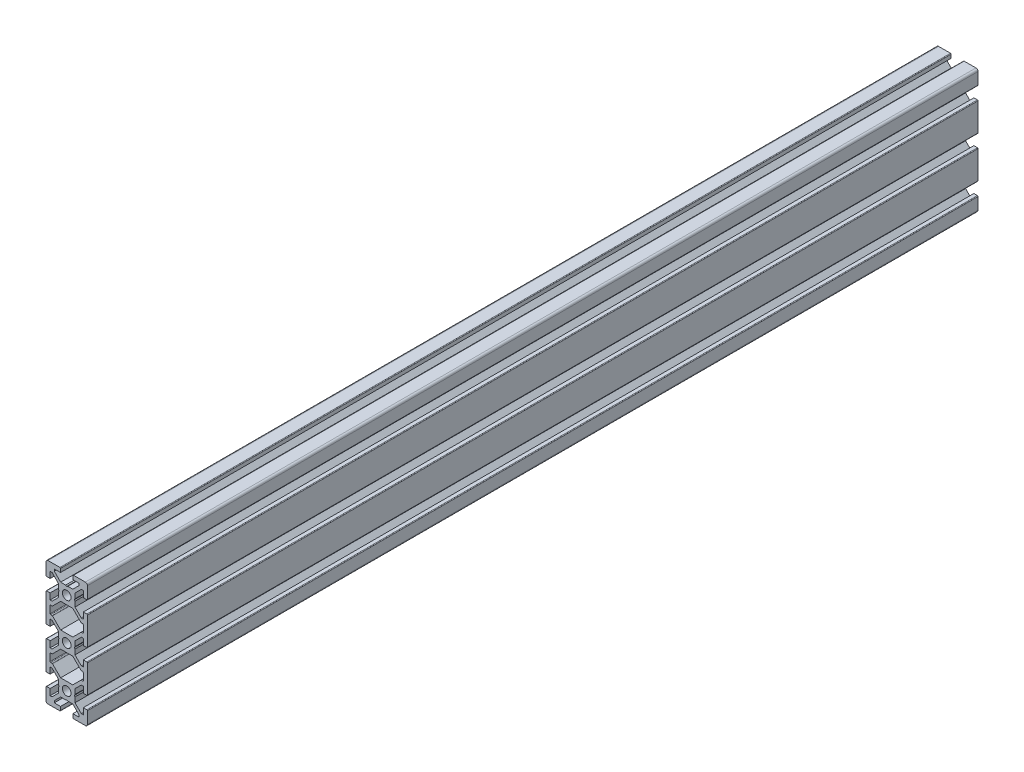
from build123d import *

# Parameters (mm, degrees)
SKETCH1_R           = 2.0999999
BOSS_EXTRUDE1_DEPTH = 430


with BuildPart() as part:
    # Sketch1 → Boss-Extrude1 (new body)
    with BuildSketch(Plane.XY):
        with BuildLine():
            Line((-10, 16.7), (-10, 3.3))
            ThreePointArc((-10, 3.3), (-9.912132034, 3.087867966), (-9.7, 3))
            Line((-9.7, 3), (-8, 3))
            Line((-8, 3), (-8, 6))
            Line((-8, 6), (-7.060650687, 6))
            Line((-7.060650687, 6), (-4, 2.939349))
            Line((-4, 2.939349), (-4, 0.519615242))
            Line((-4, 0.519615242), (-3.7, 0))
            Line((-3.7, 0), (-4, -0.519615242))
            Line((-4, -0.519615242), (-4, -2.9393502))
            Line((-4, -2.9393502), (-7.060649487, -6))
            Line((-7.060649487, -6), (-8, -6))
            Line((-8, -6), (-8, -3))
            Line((-8, -3), (-9.7, -3))
            ThreePointArc((-9.7, -3), (-9.912132034, -3.087867966), (-10, -3.3))
            Line((-10, -3.3), (-10, -16.7))
            ThreePointArc((-10, -16.7), (-9.912132034, -16.912132034), (-9.7, -17))
            Line((-9.7, -17), (-8, -17))
            Line((-8, -17), (-8, -14))
            Line((-8, -14), (-7.060672887, -14))
            Line((-7.060672887, -14), (-4, -17.0606732))
            Line((-4, -17.0606732), (-4, -19.480384758))
            Line((-4, -19.480384758), (-3.7, -20))
            Line((-3.7, -20), (-4, -20.519615242))
            Line((-4, -20.519615242), (-4, -22.93935665))
            Line((-4, -22.93935665), (-7.060643037, -26))
            Line((-7.060643037, -26), (-8, -26))
            Line((-8, -26), (-8, -23))
            Line((-8, -23), (-9.7, -23))
            ThreePointArc((-9.7, -23), (-9.912132034, -23.087867966), (-10, -23.3))
            Line((-10, -23.3), (-10, -29))
            ThreePointArc((-10, -29), (-9.707106781, -29.707106781), (-9, -30))
            Line((-9, -30), (-3.3, -30))
            ThreePointArc((-3.3, -30), (-3.087867966, -29.912132034), (-3, -29.7))
            Line((-3, -29.7), (-3, -28))
            Line((-3, -28), (-6, -28))
            Line((-6, -28), (-6, -27.060683408))
            Line((-6, -27.060683408), (-2.939316, -24))
            Line((-2.939316, -24), (-0.519095055, -24))
            Line((-0.519095055, -24), (1e-06, -23.7))
            Line((1e-06, -23.7), (0.518577868, -24))
            Line((0.518577868, -24), (2.939318, -24))
            Line((2.939318, -24), (6, -27.060682403))
            Line((6, -27.060682403), (6, -28))
            Line((6, -28), (3, -28))
            Line((3, -28), (3, -29.7))
            ThreePointArc((3, -29.7), (3.087867966, -29.912132034), (3.3, -30))
            Line((3.3, -30), (9, -30))
            ThreePointArc((9, -30), (9.707106781, -29.707106781), (10, -29))
            Line((10, -29), (10, -23.3))
            ThreePointArc((10, -23.3), (9.912132034, -23.087867966), (9.7, -23))
            Line((9.7, -23), (8, -23))
            Line((8, -23), (8, -26))
            Line((8, -26), (7.060637687, -26))
            Line((7.060637687, -26), (4, -22.93935641))
            Line((4, -22.93935641), (4, -20.519623992))
            Line((4, -20.519623992), (3.7, -20.00000875))
            Line((3.7, -20.00000875), (4, -19.480393508))
            Line((4, -19.480393508), (4, -17.06066109))
            Line((4, -17.06066109), (7.060655187, -14))
            Line((7.060655187, -14), (8, -14))
            Line((8, -14), (8, -17))
            Line((8, -17), (9.7, -17))
            ThreePointArc((9.7, -17), (9.912132034, -16.912132034), (10, -16.7))
            Line((10, -16.7), (10, -3.3))
            ThreePointArc((10, -3.3), (9.912132034, -3.087867966), (9.7, -3))
            Line((9.7, -3), (8, -3))
            Line((8, -3), (8, -6))
            Line((8, -6), (7.060651537, -6))
            Line((7.060651537, -6), (4, -2.93934815))
            Line((4, -2.93934815), (4, -0.519623992))
            Line((4, -0.519623992), (3.7, -8.75e-06))
            Line((3.7, -8.75e-06), (4, 0.519606492))
            Line((4, 0.519606492), (4, 2.9393426))
            Line((4, 2.9393426), (7.060657087, 6))
            Line((7.060657087, 6), (8, 6))
            Line((8, 6), (8, 3))
            Line((8, 3), (9.7, 3))
            ThreePointArc((9.7, 3), (9.912132034, 3.087867966), (10, 3.3))
            Line((10, 3.3), (10, 16.7))
            ThreePointArc((10, 16.7), (9.912132034, 16.912132034), (9.7, 17))
            Line((9.7, 17), (8, 17))
            Line((8, 17), (8, 14))
            Line((8, 14), (7.06065821, 14))
            Line((7.06065821, 14), (4, 17.060658523))
            Line((4, 17.060658523), (4, 19.480376008))
            Line((4, 19.480376008), (3.7, 19.99999125))
            Line((3.7, 19.99999125), (4, 20.519606492))
            Line((4, 20.519606492), (4, 22.939362173))
            Line((4, 22.939362173), (7.060637514, 26))
            Line((7.060637514, 26), (8, 26))
            Line((8, 26), (8, 23))
            Line((8, 23), (9.7, 23))
            ThreePointArc((9.7, 23), (9.912132034, 23.087867966), (10, 23.3))
            Line((10, 23.3), (10, 29))
            ThreePointArc((10, 29), (9.707106781, 29.707106781), (9, 30))
            Line((9, 30), (3.3, 30))
            ThreePointArc((3.3, 30), (3.087867966, 29.912132034), (3, 29.7))
            Line((3, 29.7), (3, 28))
            Line((3, 28), (6, 28))
            Line((6, 28), (6, 27.060684313))
            Line((6, 27.060684313), (2.939316, 24))
            Line((2.939316, 24), (0.519614242, 24))
            Line((0.519614242, 24), (-1e-06, 23.7))
            Line((-1e-06, 23.7), (-0.519616242, 24))
            Line((-0.519616242, 24), (-2.939318, 24))
            Line((-2.939318, 24), (-6, 27.060682313))
            Line((-6, 27.060682313), (-6, 28))
            Line((-6, 28), (-3, 28))
            Line((-3, 28), (-3, 29.7))
            ThreePointArc((-3, 29.7), (-3.087867966, 29.912132034), (-3.3, 30))
            Line((-3.3, 30), (-9, 30))
            ThreePointArc((-9, 30), (-9.707106781, 29.707106781), (-10, 29))
            Line((-10, 29), (-10, 23.3))
            ThreePointArc((-10, 23.3), (-9.912132034, 23.087867966), (-9.7, 23))
            Line((-9.7, 23), (-8, 23))
            Line((-8, 23), (-8, 26))
            Line((-8, 26), (-7.060644014, 26))
            Line((-7.060644014, 26), (-4, 22.939355673))
            Line((-4, 22.939355673), (-4, 20.519615242))
            Line((-4, 20.519615242), (-3.7, 20))
            Line((-3.7, 20), (-4, 19.480384758))
            Line((-4, 19.480384758), (-4, 17.060669373))
            Line((-4, 17.060669373), (-7.06066906, 14))
            Line((-7.06066906, 14), (-8, 14))
            Line((-8, 14), (-8, 17))
            Line((-8, 17), (-9.7, 17))
            ThreePointArc((-9.7, 17), (-9.912132034, 16.912132034), (-10, 16.7))
        make_face()
        with Locations((0, 20.000013123)):
            Circle(SKETCH1_R, mode=Mode.SUBTRACT)
        Circle(SKETCH1_R, mode=Mode.SUBTRACT)
        with Locations((0, -20.000013525)):
            Circle(SKETCH1_R, mode=Mode.SUBTRACT)
        with BuildLine():
            Line((-7.7, 8), (-7.063594325, 8))
            ThreePointArc((-7.063594325, 8), (-6.948789288, 7.977163857), (-6.85146228, 7.912132024))
            Line((-6.85146228, 7.912132024), (-2.939330656, 4))
            Line((-2.939330656, 4), (2.939337056, 4))
            Line((2.939337056, 4), (6.85146868, 7.912132024))
            ThreePointArc((6.85146868, 7.912132024), (6.948795688, 7.977163857), (7.063600725, 8))
            Line((7.063600725, 8), (7.7, 8))
            ThreePointArc((7.7, 8), (7.912132034, 8.087867966), (8, 8.3))
            Line((8, 8.3), (8, 11.7))
            ThreePointArc((8, 11.7), (7.912132034, 11.912132034), (7.7, 12))
            Line((7.7, 12), (7.063601848, 12))
            ThreePointArc((7.063601848, 12), (6.948796811, 12.022836143), (6.851469803, 12.087867976))
            Line((6.851469803, 12.087867976), (2.939338179, 16))
            Line((2.939338179, 16), (-2.939349029, 16))
            Line((-2.939349029, 16), (-6.851480653, 12.087867976))
            ThreePointArc((-6.851480653, 12.087867976), (-6.948807661, 12.022836143), (-7.063612698, 12))
            Line((-7.063612698, 12), (-7.7, 12))
            ThreePointArc((-7.7, 12), (-7.912132034, 11.912132034), (-8, 11.7))
            Line((-8, 11.7), (-8, 8.3))
            ThreePointArc((-8, 8.3), (-7.912132034, 8.087867966), (-7.7, 8))
        make_face(mode=Mode.SUBTRACT)
        with BuildLine():
            Line((-8, -8.3), (-8, -11.7))
            ThreePointArc((-8, -11.7), (-7.912132034, -11.912132034), (-7.7, -12))
            Line((-7.7, -12), (-7.063616525, -12))
            ThreePointArc((-7.063616525, -12), (-6.948811488, -12.022836143), (-6.85148448, -12.087867976))
            Line((-6.85148448, -12.087867976), (-2.939352856, -16))
            Line((-2.939352856, -16), (2.939340746, -16))
            Line((2.939340746, -16), (6.851465031, -12.08786817))
            ThreePointArc((6.851465031, -12.08786817), (6.948792107, -12.022836196), (7.06359727, -12))
            Line((7.06359727, -12), (7.7, -12))
            ThreePointArc((7.7, -12), (7.912132034, -11.912132034), (8, -11.7))
            Line((8, -11.7), (8, -8.3))
            ThreePointArc((8, -8.3), (7.912132034, -8.087867966), (7.7, -8))
            Line((7.7, -8), (7.063595175, -8))
            ThreePointArc((7.063595175, -8), (6.948790138, -7.977163857), (6.85146313, -7.912132024))
            Line((6.85146313, -7.912132024), (2.939331506, -4))
            Line((2.939331506, -4), (-2.939329456, -4))
            Line((-2.939329456, -4), (-6.85146108, -7.912132024))
            ThreePointArc((-6.85146108, -7.912132024), (-6.948788088, -7.977163857), (-7.063593125, -8))
            Line((-7.063593125, -8), (-7.7, -8))
            ThreePointArc((-7.7, -8), (-7.912132034, -8.087867966), (-8, -8.3))
        make_face(mode=Mode.SUBTRACT)
    extrude(amount=-BOSS_EXTRUDE1_DEPTH)


solid = part.part
